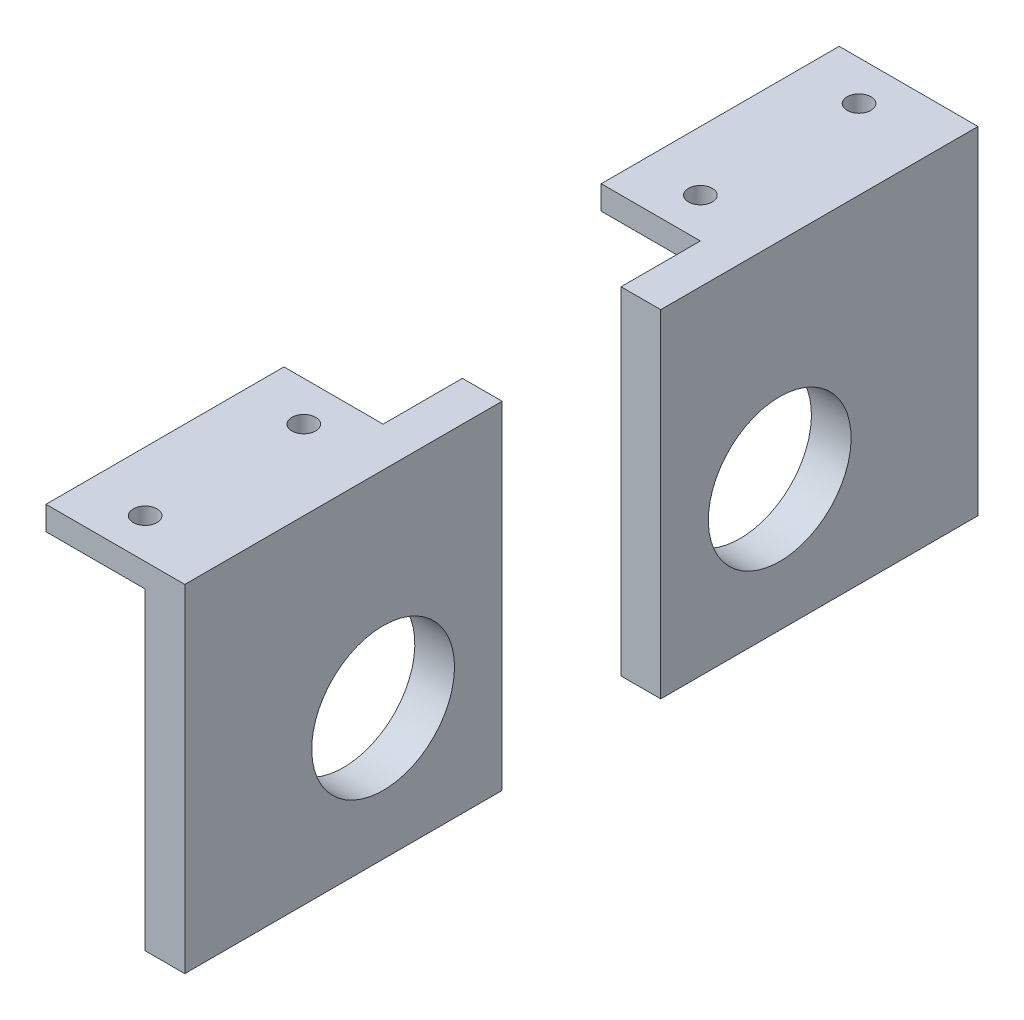
from build123d import *

# Parameters (mm, degrees)
EXTRUDE_1_DEPTH     = 5
SKETCH_2_R          = 9
CUT_EXTRUDE_1_DEPTH = 5
EXTRUDE_2_DEPTH     = 3
SKETCH_6_R          = 1.5
CUT_EXTRUDE_2_DEPTH = 3


with BuildPart() as part:
    # 草图1 → 凸台-拉伸1 (new body)
    with BuildSketch(Plane(origin=(0, 0, 0), x_dir=(0, 0, -1), z_dir=(1, 0, 0))):
        Polygon((-15, -28.5), (-15, 11), (15, 11), (25, 11), (25, -8.5), (25, -28.5), (15, -28.5), align=None)
    extrude(amount=EXTRUDE_1_DEPTH)

    # 草图2 → 切除-拉伸1 (cut)
    with BuildSketch(Plane(origin=(5, 0, 0), x_dir=(0, 0, -1), z_dir=(1, 0, 0))):
        with Locations(Location((10, -12, 0), (0, 0, 90))):
            Circle(SKETCH_2_R)
    extrude(amount=-CUT_EXTRUDE_1_DEPTH, mode=Mode.SUBTRACT)

    # 草图3 → 凸台-拉伸2 (add)
    with BuildSketch(Plane(origin=(0, 11, 0), x_dir=(1, 0, 0), z_dir=(0, 1, 0))):
        Polygon((5, 15), (5, 25), (0, 25), (0, 15), (-12.5, 15), (-12.5, -15), (5, -15), align=None)
    extrude(amount=EXTRUDE_2_DEPTH)

    # 草图6 → 切除-拉伸2 (cut)
    with BuildSketch(Plane(origin=(0, 14, 0), x_dir=(1, 0, 0), z_dir=(0, 1, 0))):
        with Locations(Location((-5, 10, 0), (0, 0, 270))):
            Circle(SKETCH_6_R)
        with Locations(Location((-5, -10, 0), (0, 0, 270))):
            Circle(SKETCH_6_R)
    extrude(amount=-CUT_EXTRUDE_2_DEPTH, mode=Mode.SUBTRACT)


with BuildPart() as body_2:
    # 镜向1: mirrored copy
    add(part.part.mirror(Plane(origin=(0, 0, -35), x_dir=(1, 0, 0), z_dir=(0, 0, -1))))


solid = Compound([part.part, body_2.part])
